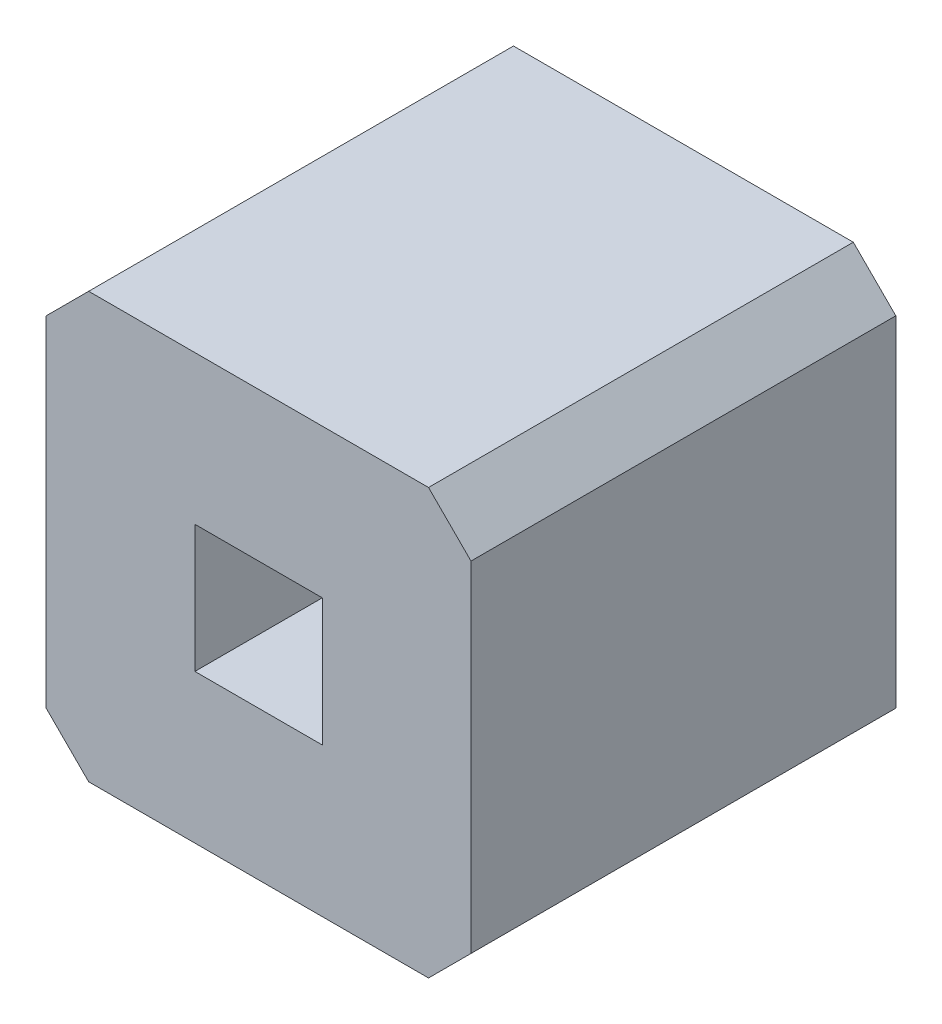
from build123d import *

# Parameters (mm, degrees)
SKETCH1_W           = 0.75
SKETCH1_H           = 0.75
BOSS_EXTRUDE1_DEPTH = 2.5


with BuildPart() as part:
    # Sketch1 → Boss-Extrude1 (new body)
    with BuildSketch(Plane.XY):
        Polygon((0, 2.25), (0.25, 2.5), (2.25, 2.5), (2.5, 2.25), (2.5, 0.25), (2.25, 0), (0.25, 0), (0, 0.25), align=None)
        with Locations((1.25, 1.25)):
            Rectangle(SKETCH1_W, SKETCH1_H, mode=Mode.SUBTRACT)
    extrude(amount=BOSS_EXTRUDE1_DEPTH)


solid = part.part
